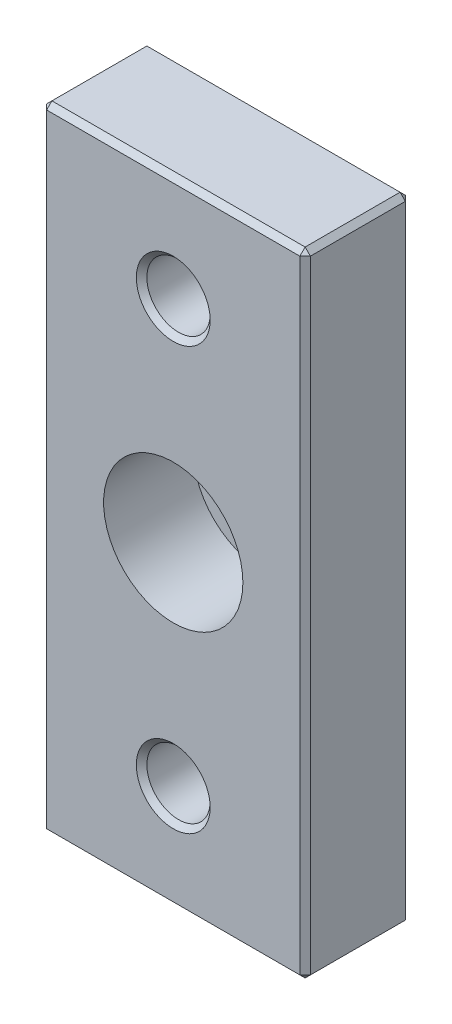
from build123d import *

# Parameters (mm, degrees)
ESQUISSE1_W             = 25
ESQUISSE1_H             = 60
ESQUISSE1_R             = 3
ESQUISSE1_R_2           = 4.1
BASE_EXTRUSION_DEPTH    = 10
CHANFREIN1_SIZE         = 0.5
ESQUISSE2_R             = 6.6
ENL_V_MAT_EXTRU_1_DEPTH = 8.5


with BuildPart() as part:
    # Esquisse1 → Base-Extrusion (new body)
    with BuildSketch(Plane.XY):
        with Locations((12.5, 30)):
            Rectangle(ESQUISSE1_W, ESQUISSE1_H)
        with Locations((12.5, 50)):
            Circle(ESQUISSE1_R, mode=Mode.SUBTRACT)
        with Locations((12.5, 10)):
            Circle(ESQUISSE1_R, mode=Mode.SUBTRACT)
        with Locations((12.5, 30)):
            Circle(ESQUISSE1_R_2, mode=Mode.SUBTRACT)
    extrude(amount=BASE_EXTRUSION_DEPTH)

    # Chanfrein1
    chanfrein1_edges = [part.edges().sort_by_distance(p)[0] for p in [
        (0, 0, 5),
        (25, 0, 5),
        (12.5, 0, 0),
        (12.5, 0, 10),
        (25, 60, 5),
        (25, 30, 0),
        (25, 30, 10),
        (0, 60, 5),
        (12.5, 60, 0),
        (12.5, 60, 10),
        (0, 30, 0),
        (0, 30, 10),
        (9.5, 50, 10),
        (9.5, 10, 10),
    ]]
    chamfer(chanfrein1_edges, length=CHANFREIN1_SIZE)

    # Esquisse2 → Enlèv. mat.-Extru.1 (cut)
    with BuildSketch(Plane.XY.offset(10)):
        with Locations((12.5, 30)):
            Circle(ESQUISSE2_R)
    extrude(amount=-ENL_V_MAT_EXTRU_1_DEPTH, mode=Mode.SUBTRACT)


solid = part.part
